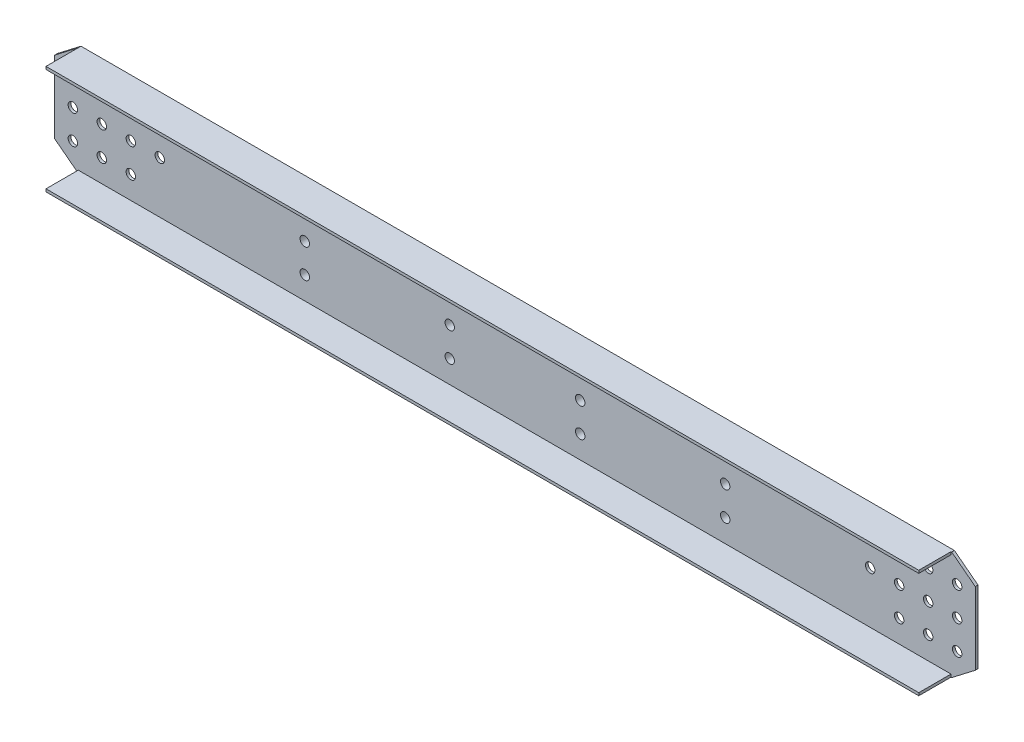
from build123d import *

# Parameters (mm, degrees)
SKETCH_1_R          = 13
EXTRUDE_639_DEPTH   = 7.5
SKETCH_2_W          = 2408.049034164
SKETCH_2_H          = 7.5
EXTRUDE_1_DEPTH     = 89
SKETCH_3_W          = 80
SKETCH_3_H          = 240
EXTRUDE_2_DEPTH     = 16
SKETCH_4_R          = 13
CUT_EXTRUDE_1_DEPTH = 1308.983562588


with BuildPart() as part:
    # 草图1 → Extrude 639 (new body)
    with BuildSketch(Plane.XY):
        Polygon((-1205, 0), (1205, 0), (1270, 50), (1270, 250), (1205, 300), (-1205, 300), (-1270, 250), (-1270, 50), align=None)
        with Locations((-1220, 230)):
            Circle(SKETCH_1_R, mode=Mode.SUBTRACT)
        with Locations((-1220, 150)):
            Circle(SKETCH_1_R, mode=Mode.SUBTRACT)
        with Locations((-1140, 230)):
            Circle(SKETCH_1_R, mode=Mode.SUBTRACT)
        with Locations((-1140, 150)):
            Circle(SKETCH_1_R, mode=Mode.SUBTRACT)
        with Locations((-1060, 230)):
            Circle(SKETCH_1_R, mode=Mode.SUBTRACT)
        with Locations((-1060, 150)):
            Circle(SKETCH_1_R, mode=Mode.SUBTRACT)
        with Locations((-980, 150)):
            Circle(SKETCH_1_R, mode=Mode.SUBTRACT)
        with Locations(Location((-1060, 70, 0), (0, 0, 180))):
            Circle(SKETCH_1_R, mode=Mode.SUBTRACT)
        with Locations(Location((-1140, 70, 0), (0, 0, 180))):
            Circle(SKETCH_1_R, mode=Mode.SUBTRACT)
        with Locations(Location((-1220, 70, 0), (0, 0, 180))):
            Circle(SKETCH_1_R, mode=Mode.SUBTRACT)
        with Locations((1220, 70)):
            Circle(SKETCH_1_R, mode=Mode.SUBTRACT)
        with Locations((1140, 70)):
            Circle(SKETCH_1_R, mode=Mode.SUBTRACT)
        with Locations((1060, 70)):
            Circle(SKETCH_1_R, mode=Mode.SUBTRACT)
        with Locations(Location((980, 150, 0), (0, 0, 180))):
            Circle(SKETCH_1_R, mode=Mode.SUBTRACT)
        with Locations(Location((1060, 150, 0), (0, 0, 180))):
            Circle(SKETCH_1_R, mode=Mode.SUBTRACT)
        with Locations(Location((1060, 230, 0), (0, 0, 180))):
            Circle(SKETCH_1_R, mode=Mode.SUBTRACT)
        with Locations(Location((1140, 150, 0), (0, 0, 180))):
            Circle(SKETCH_1_R, mode=Mode.SUBTRACT)
        with Locations(Location((1140, 230, 0), (0, 0, 180))):
            Circle(SKETCH_1_R, mode=Mode.SUBTRACT)
        with Locations(Location((1220, 150, 0), (0, 0, 180))):
            Circle(SKETCH_1_R, mode=Mode.SUBTRACT)
        with Locations(Location((1220, 230, 0), (0, 0, 180))):
            Circle(SKETCH_1_R, mode=Mode.SUBTRACT)
    extrude(amount=-EXTRUDE_639_DEPTH)

    # 草图2 → 凸台-拉伸1 (add)
    with BuildSketch(Plane.XY):
        with Locations((-0.975482918, 296.25)):
            Rectangle(SKETCH_2_W, SKETCH_2_H)
        with Locations((-0.975482918, 3.75)):
            Rectangle(SKETCH_2_W, SKETCH_2_H)
    extrude(amount=EXTRUDE_1_DEPTH)

    # 草图3 → 凸台-拉伸2 (add)
    with BuildSketch(Plane(origin=(0, 0, -7.5), x_dir=(-1, 0, 0), z_dir=(0, 0, -1))):
        with Locations((-580, 150)):
            Rectangle(SKETCH_3_W, SKETCH_3_H)
        with Locations((-180, 150)):
            Rectangle(SKETCH_3_W, SKETCH_3_H)
        with Locations((180, 150)):
            Rectangle(SKETCH_3_W, SKETCH_3_H)
        with Locations((580, 150)):
            Rectangle(SKETCH_3_W, SKETCH_3_H)
    extrude(amount=EXTRUDE_2_DEPTH)

    # 草图4 → 切除-拉伸1 (cut, through all)
    with BuildSketch(Plane.XY):
        with Locations((-580, 230)):
            Circle(SKETCH_4_R)
        with Locations((-580, 150)):
            Circle(SKETCH_4_R)
        with Locations((-180, 230)):
            Circle(SKETCH_4_R)
        with Locations((-180, 150)):
            Circle(SKETCH_4_R)
        with Locations(Location((-180, 70, 0), (0, 0, 180))):
            Circle(SKETCH_4_R)
        with Locations(Location((-580, 70, 0), (0, 0, 180))):
            Circle(SKETCH_4_R)
        with Locations((580, 70)):
            Circle(SKETCH_4_R)
        with Locations((180, 70)):
            Circle(SKETCH_4_R)
        with Locations(Location((180, 150, 0), (0, 0, 180))):
            Circle(SKETCH_4_R)
        with Locations(Location((180, 230, 0), (0, 0, 180))):
            Circle(SKETCH_4_R)
        with Locations(Location((580, 150, 0), (0, 0, 180))):
            Circle(SKETCH_4_R)
        with Locations(Location((580, 230, 0), (0, 0, 180))):
            Circle(SKETCH_4_R)
    extrude(amount=-CUT_EXTRUDE_1_DEPTH, mode=Mode.SUBTRACT)


solid = part.part
